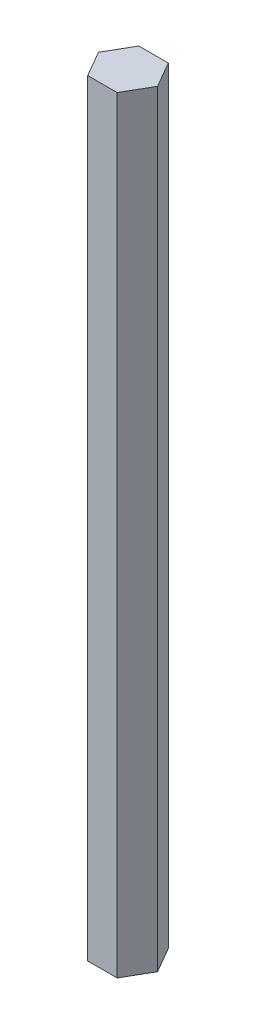
from build123d import *

# Parameters (mm, degrees)
BOSS_EXTRUDE1_DEPTH = 75


with BuildPart() as part:
    # Sketch1 → Boss-Extrude1 (new body)
    with BuildSketch(Plane(origin=(0, 0, 0), x_dir=(1, 0, 0), z_dir=(0, 1, 0))):
        Polygon((1.443375673, -2.5), (2.886751346, 0), (1.443375673, 2.5), (-1.443375673, 2.5), (-2.886751346, 0), (-1.443375673, -2.5), align=None)
    extrude(amount=BOSS_EXTRUDE1_DEPTH)


solid = part.part
